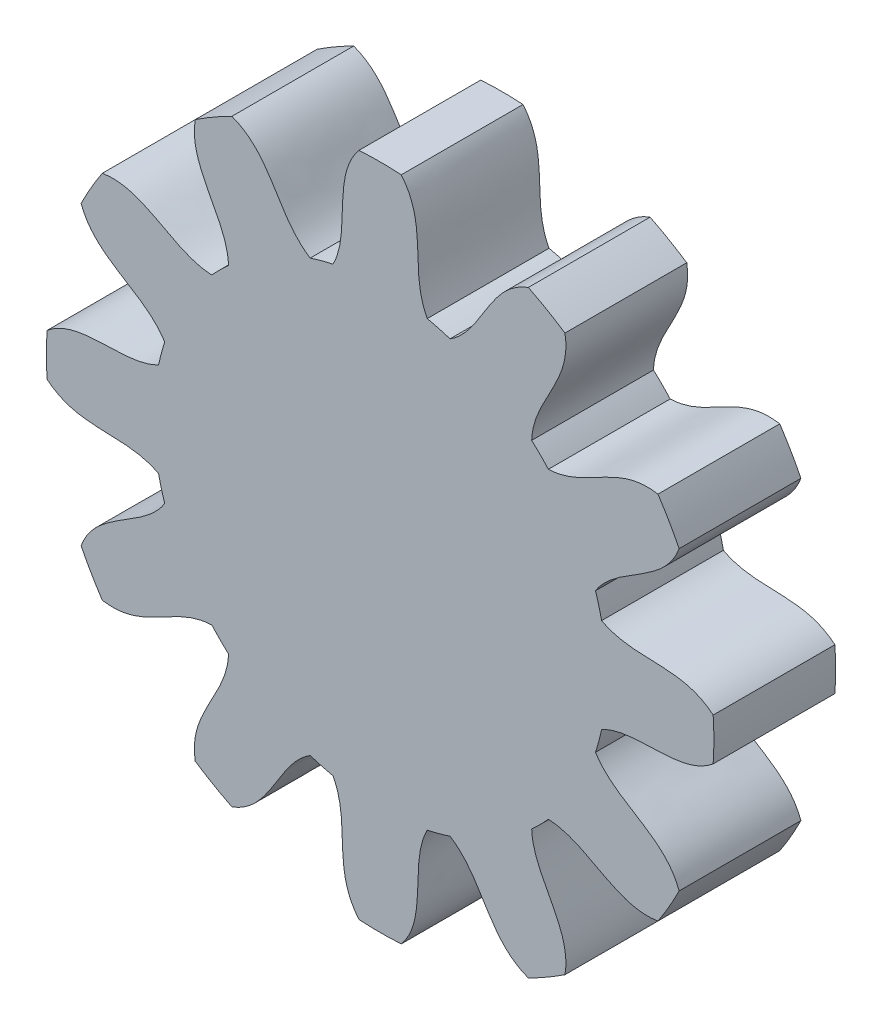
from build123d import *

# Parameters (mm, degrees)
EXTRUDE_1_DEPTH      = 1
EXTRUDE_1_DEPTH_BACK = 3.597865908
SKETCH_2_R           = 2.5
CUT_EXTRUDE_1_DEPTH  = 1


with BuildPart() as part:
    # 草图1 → 凸台-拉伸1 (new, two sides: drawn at the far end of the back side and taken through both)
    with BuildSketch(Plane.XY.offset(-EXTRUDE_1_DEPTH_BACK)):
        with BuildLine():
            ThreePointArc((-2.640449702, -8.132067718), (-2.212902836, -8.258665815), (-1.779337339, -8.36280208))
            add(Edge.make_bspline(
                [(-0.798942675, -12.574644751), (-1.838065444, -11.330781503), (-1.08287755, -9.669464778), (-1.779337339, -8.36280208)],
                knots=[0, 0, 0, 0, 1, 1, 1, 1], degree=3))
            ThreePointArc((-0.798942675, -12.574644751), (0, -12.6), (0.798942675, -12.574644751))
            add(Edge.make_bspline(
                [(0.798942675, -12.574644751), (1.838065444, -11.330781503), (1.08287755, -9.669464778), (1.779337339, -8.36280208)],
                knots=[0, 0, 0, 0, 1, 1, 1, 1], degree=3))
            ThreePointArc((1.779337339, -8.36280208), (2.212902836, -8.258665815), (2.640449702, -8.132067718))
            add(Edge.make_bspline(
                [(5.595417723, -11.289433135), (4.073579383, -10.731777349), (3.896932922, -8.915440914), (2.640449702, -8.132067718)],
                knots=[0, 0, 0, 0, 1, 1, 1, 1], degree=3))
            ThreePointArc((5.595417723, -11.289433135), (6.3, -10.911920088), (6.979227028, -10.49049046))
            add(Edge.make_bspline(
                [(6.979227028, -10.49049046), (7.25720212, -8.893711904), (5.772531856, -7.832563364), (5.722352378, -6.352730379)],
                knots=[0, 0, 0, 0, 1, 1, 1, 1], degree=3))
            ThreePointArc((5.722352378, -6.352730379), (6.045762979, -6.045762979), (6.352730379, -5.722352378))
            add(Edge.make_bspline(
                [(10.49049046, -6.979227028), (8.893711904, -7.25720212), (7.832563364, -5.772531856), (6.352730379, -5.722352378)],
                knots=[0, 0, 0, 0, 1, 1, 1, 1], degree=3))
            ThreePointArc((10.49049046, -6.979227028), (10.911920088, -6.3), (11.289433135, -5.595417723))
            add(Edge.make_bspline(
                [(11.289433135, -5.595417723), (10.731777349, -4.073579383), (8.915440914, -3.896932922), (8.132067718, -2.640449702)],
                knots=[0, 0, 0, 0, 1, 1, 1, 1], degree=3))
            ThreePointArc((8.132067718, -2.640449702), (8.258665815, -2.212902836), (8.36280208, -1.779337339))
            add(Edge.make_bspline(
                [(12.574644751, -0.798942675), (11.330781503, -1.838065444), (9.669464778, -1.08287755), (8.36280208, -1.779337339)],
                knots=[0, 0, 0, 0, 1, 1, 1, 1], degree=3))
            ThreePointArc((12.574644751, -0.798942675), (12.6, 0), (12.574644751, 0.798942675))
            add(Edge.make_bspline(
                [(12.574644751, 0.798942675), (11.330781503, 1.838065444), (9.669464778, 1.08287755), (8.36280208, 1.779337339)],
                knots=[0, 0, 0, 0, 1, 1, 1, 1], degree=3))
            ThreePointArc((8.36280208, 1.779337339), (8.258665815, 2.212902836), (8.132067718, 2.640449702))
            add(Edge.make_bspline(
                [(11.289433135, 5.595417723), (10.731777349, 4.073579383), (8.915440914, 3.896932922), (8.132067718, 2.640449702)],
                knots=[0, 0, 0, 0, 1, 1, 1, 1], degree=3))
            ThreePointArc((11.289433135, 5.595417723), (10.911920088, 6.3), (10.49049046, 6.979227028))
            add(Edge.make_bspline(
                [(10.49049046, 6.979227028), (8.893711904, 7.25720212), (7.832563364, 5.772531856), (6.352730379, 5.722352378)],
                knots=[0, 0, 0, 0, 1, 1, 1, 1], degree=3))
            ThreePointArc((6.352730379, 5.722352378), (6.045762979, 6.045762979), (5.722352378, 6.352730379))
            add(Edge.make_bspline(
                [(6.979227028, 10.49049046), (7.25720212, 8.893711904), (5.772531856, 7.832563364), (5.722352378, 6.352730379)],
                knots=[0, 0, 0, 0, 1, 1, 1, 1], degree=3))
            ThreePointArc((6.979227028, 10.49049046), (6.3, 10.911920088), (5.595417723, 11.289433135))
            add(Edge.make_bspline(
                [(5.595417723, 11.289433135), (4.073579383, 10.731777349), (3.896932922, 8.915440914), (2.640449702, 8.132067718)],
                knots=[0, 0, 0, 0, 1, 1, 1, 1], degree=3))
            ThreePointArc((2.640449702, 8.132067718), (2.212902836, 8.258665815), (1.779337339, 8.36280208))
            add(Edge.make_bspline(
                [(0.798942675, 12.574644751), (1.838065444, 11.330781503), (1.08287755, 9.669464778), (1.779337339, 8.36280208)],
                knots=[0, 0, 0, 0, 1, 1, 1, 1], degree=3))
            ThreePointArc((0.798942675, 12.574644751), (0, 12.6), (-0.798942675, 12.574644751))
            add(Edge.make_bspline(
                [(-0.798942675, 12.574644751), (-1.838065444, 11.330781503), (-1.08287755, 9.669464778), (-1.779337339, 8.36280208)],
                knots=[0, 0, 0, 0, 1, 1, 1, 1], degree=3))
            ThreePointArc((-1.779337339, 8.36280208), (-2.212902836, 8.258665815), (-2.640449702, 8.132067718))
            add(Edge.make_bspline(
                [(-5.595417723, 11.289433135), (-4.073579383, 10.731777349), (-3.896932922, 8.915440914), (-2.640449702, 8.132067718)],
                knots=[0, 0, 0, 0, 1, 1, 1, 1], degree=3))
            ThreePointArc((-5.595417723, 11.289433135), (-6.3, 10.911920088), (-6.979227028, 10.49049046))
            add(Edge.make_bspline(
                [(-6.979227028, 10.49049046), (-7.25720212, 8.893711904), (-5.772531856, 7.832563364), (-5.722352378, 6.352730379)],
                knots=[0, 0, 0, 0, 1, 1, 1, 1], degree=3))
            ThreePointArc((-5.722352378, 6.352730379), (-6.045762979, 6.045762979), (-6.352730379, 5.722352378))
            add(Edge.make_bspline(
                [(-10.49049046, 6.979227028), (-8.893711904, 7.25720212), (-7.832563364, 5.772531856), (-6.352730379, 5.722352378)],
                knots=[0, 0, 0, 0, 1, 1, 1, 1], degree=3))
            ThreePointArc((-10.49049046, 6.979227028), (-10.911920088, 6.3), (-11.289433135, 5.595417723))
            add(Edge.make_bspline(
                [(-11.289433135, 5.595417723), (-10.731777349, 4.073579383), (-8.915440914, 3.896932922), (-8.132067718, 2.640449702)],
                knots=[0, 0, 0, 0, 1, 1, 1, 1], degree=3))
            ThreePointArc((-8.132067718, 2.640449702), (-8.258665815, 2.212902836), (-8.36280208, 1.779337339))
            add(Edge.make_bspline(
                [(-12.574644751, 0.798942675), (-11.330781503, 1.838065444), (-9.669464778, 1.08287755), (-8.36280208, 1.779337339)],
                knots=[0, 0, 0, 0, 1, 1, 1, 1], degree=3))
            ThreePointArc((-12.574644751, 0.798942675), (-12.6, 0), (-12.574644751, -0.798942675))
            add(Edge.make_bspline(
                [(-12.574644751, -0.798942675), (-11.330781503, -1.838065444), (-9.669464778, -1.08287755), (-8.36280208, -1.779337339)],
                knots=[0, 0, 0, 0, 1, 1, 1, 1], degree=3))
            ThreePointArc((-8.36280208, -1.779337339), (-8.258665815, -2.212902836), (-8.132067718, -2.640449702))
            add(Edge.make_bspline(
                [(-11.289433135, -5.595417723), (-10.731777349, -4.073579383), (-8.915440914, -3.896932922), (-8.132067718, -2.640449702)],
                knots=[0, 0, 0, 0, 1, 1, 1, 1], degree=3))
            ThreePointArc((-11.289433135, -5.595417723), (-10.911920088, -6.3), (-10.49049046, -6.979227028))
            add(Edge.make_bspline(
                [(-10.49049046, -6.979227028), (-8.893711904, -7.25720212), (-7.832563364, -5.772531856), (-6.352730379, -5.722352378)],
                knots=[0, 0, 0, 0, 1, 1, 1, 1], degree=3))
            ThreePointArc((-6.352730379, -5.722352378), (-6.045762979, -6.045762979), (-5.722352378, -6.352730379))
            add(Edge.make_bspline(
                [(-6.979227028, -10.49049046), (-7.25720212, -8.893711904), (-5.772531856, -7.832563364), (-5.722352378, -6.352730379)],
                knots=[0, 0, 0, 0, 1, 1, 1, 1], degree=3))
            ThreePointArc((-6.979227028, -10.49049046), (-6.3, -10.911920088), (-5.595417723, -11.289433135))
            add(Edge.make_bspline(
                [(-5.595417723, -11.289433135), (-4.073579383, -10.731777349), (-3.896932922, -8.915440914), (-2.640449702, -8.132067718)],
                knots=[0, 0, 0, 0, 1, 1, 1, 1], degree=3))
        make_face()
    extrude(amount=EXTRUDE_1_DEPTH + EXTRUDE_1_DEPTH_BACK)

    # 草图2 → 切除-拉伸1 (cut)
    with BuildSketch(Plane(origin=(0, 0, -3.597865908), x_dir=(-1, 0, 0), z_dir=(0, 0, -1))):
        Circle(SKETCH_2_R)
    extrude(amount=-CUT_EXTRUDE_1_DEPTH, mode=Mode.SUBTRACT)


solid = part.part
